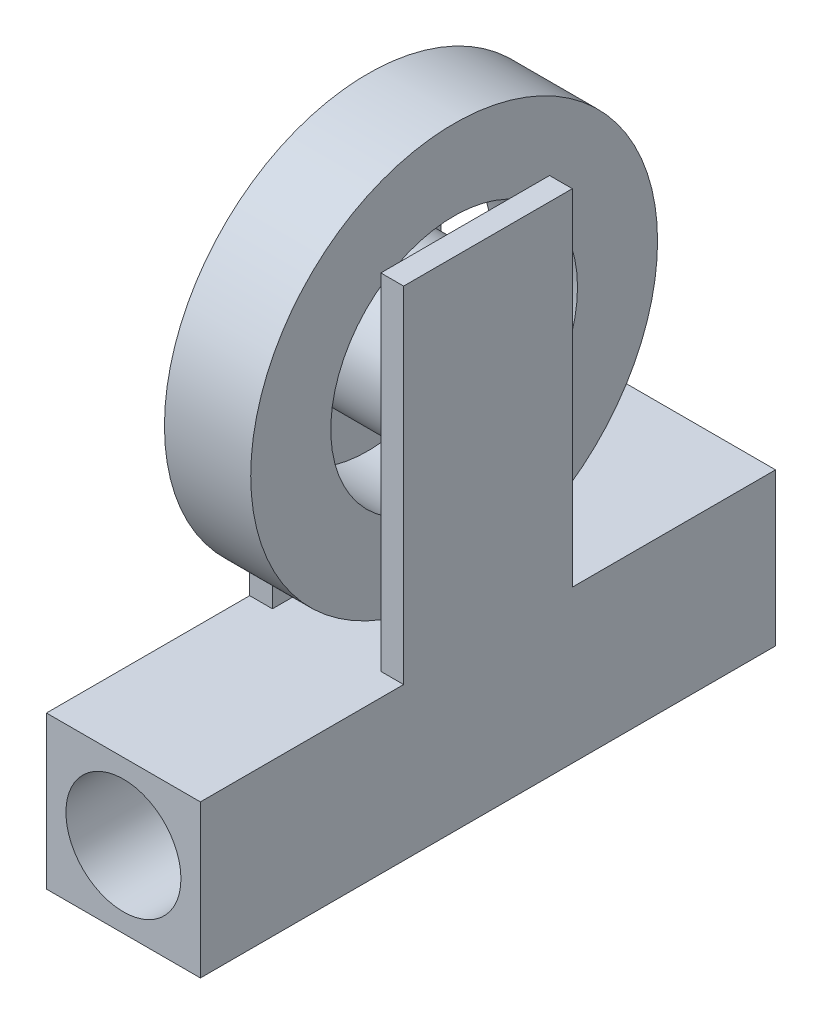
from build123d import *

# Parameters (mm, degrees)
SKETCH1_W           = 26.76896329
SKETCH1_H           = 26.518786064
SKETCH1_R           = 10
BOSS_EXTRUDE1_DEPTH = 100
SKETCH2_W           = 3.96078439
SKETCH2_H           = 29.33085839
BOSS_EXTRUDE2_DEPTH = 60
SKETCH3_R           = 12.742651411
BOSS_EXTRUDE3_DEPTH = 22.8081789
SKETCH4_R           = 35.368420272
SKETCH4_R_2         = 21.450602769
BOSS_EXTRUDE4_DEPTH = 7.5


with BuildPart() as part:
    # Sketch1 → Boss-Extrude1 (new body)
    with BuildSketch(Plane.XY):
        Rectangle(SKETCH1_W, SKETCH1_H)
        Circle(SKETCH1_R, mode=Mode.SUBTRACT)
    extrude(amount=BOSS_EXTRUDE1_DEPTH)

    # Sketch2 → Boss-Extrude2 (add)
    with BuildSketch(Plane(origin=(0, 13.259393032, 0), x_dir=(1, 0, 0), z_dir=(0, 1, 0))):
        with Locations((-11.40408945, -50)):
            Rectangle(SKETCH2_W, SKETCH2_H)
        with Locations((11.40408945, -50)):
            Rectangle(SKETCH2_W, SKETCH2_H)
    extrude(amount=BOSS_EXTRUDE2_DEPTH)

    # Sketch3 → Boss-Extrude3 (add)
    with BuildSketch(Plane(origin=(13.384481645, 0, 0), x_dir=(0, 0, -1), z_dir=(1, 0, 0))):
        with Locations((-50, 52.099149036)):
            Circle(SKETCH3_R)
    extrude(amount=-BOSS_EXTRUDE3_DEPTH)


with BuildPart() as body_2:
    # Sketch4 → Boss-Extrude4 (new, symmetric)
    with BuildSketch(Plane(origin=(0, 0, 0), x_dir=(0, 0, -1), z_dir=(1, 0, 0))):
        with Locations((-50, 52.099149036)):
            Circle(SKETCH4_R)
        with Locations((-50, 52.099149036)):
            Circle(SKETCH4_R_2, mode=Mode.SUBTRACT)
    extrude(amount=BOSS_EXTRUDE4_DEPTH, both=True)


solid = Compound([part.part, body_2.part])
